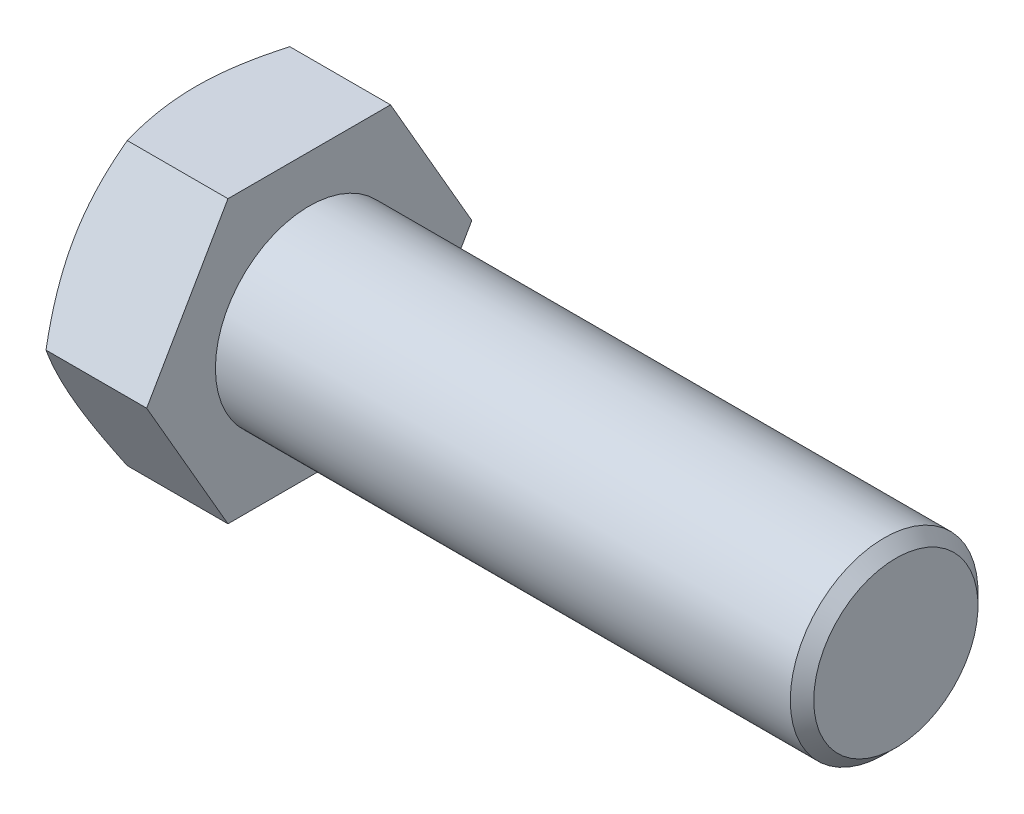
from build123d import *

# Parameters (mm, degrees)
SKETCH_2_OUTSIDE_W  = 23.028
SKETCH_2_OUTSIDE_H  = 23.028
CUT_EXTRUDE_1_DEPTH = 32.560256653
CHAMFER_1_SIZE      = 0.5


with BuildPart() as part:
    # Эскиз1 → Повернуть1 (revolve)
    with BuildSketch(Plane.XY, mode=Mode.PRIVATE) as revolve_1_sk:
        Polygon((0, 0), (0, 5.7), (0.710140831, 6.93), (5, 6.93), (5, 4), (30, 4), (30, 0), align=None)
    revolve(revolve_1_sk.sketch.rotate(Axis((0, 0, 0), (1, 0, 0)), 90), axis=Axis((0, 0, 0), (1, 0, 0)))

    # Эскиз2 outside → Вырез-Вытянуть1 (cut, through all)
    with BuildSketch(Plane(origin=(0, 0, 0), x_dir=(0, 0, -1), z_dir=(1, 0, 0))):
        Rectangle(SKETCH_2_OUTSIDE_W, SKETCH_2_OUTSIDE_H)
        Polygon((6.92820323, 0), (3.464101615, 6), (-3.464101615, 6), (-6.92820323, 0), (-3.464101615, -6), (3.464101615, -6), align=None, mode=Mode.SUBTRACT)
    extrude(amount=CUT_EXTRUDE_1_DEPTH, mode=Mode.SUBTRACT)

    # Фаска1
    chamfer_1_edges = [part.edges().sort_by_distance(p)[0] for p in [
        (30, 0, -4),
    ]]
    chamfer(chamfer_1_edges, length=CHAMFER_1_SIZE)


solid = part.part
